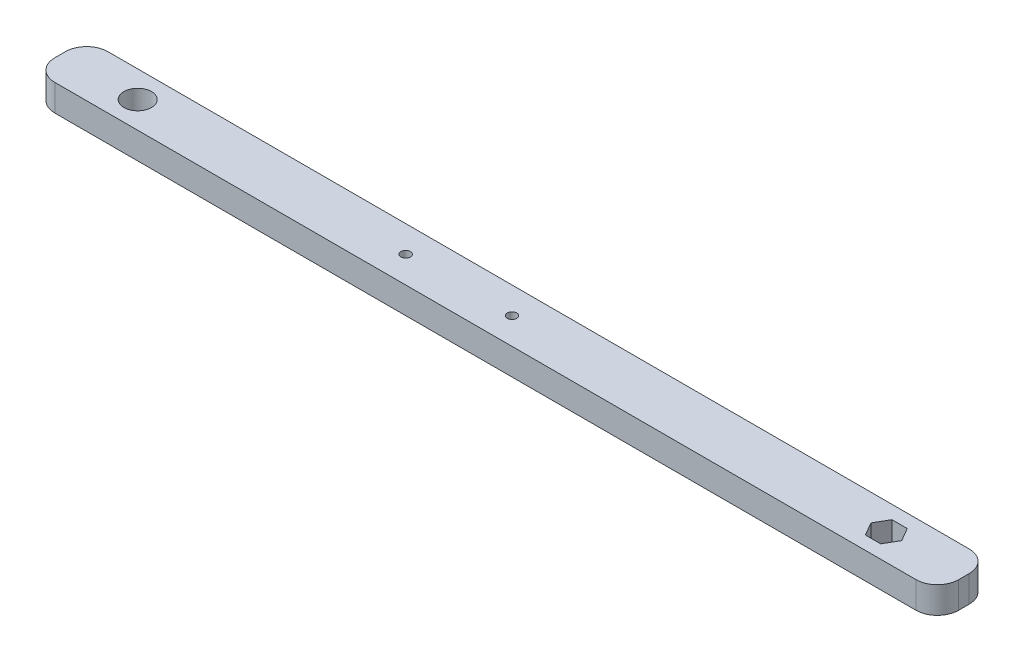
from build123d import *

# Parameters (mm, degrees)
SKETCH1_W           = 215.9
SKETCH1_H           = 12.7
SKETCH1_R           = 3.302
BOSS_EXTRUDE1_DEPTH = 6.35
FILLET1_R           = 5.08
SKETCH4_R           = 1.1303
CUT_EXTRUDE1_DEPTH  = 21.59


with BuildPart() as part:
    # Sketch1 → Boss-Extrude1 (new body)
    with BuildSketch(Plane(origin=(0, 0, 0), x_dir=(1, 0, 0), z_dir=(0, 1, 0))):
        with Locations((107.95, 6.35)):
            Rectangle(SKETCH1_W, SKETCH1_H)
        with Locations(Location((18.542, 6.35, 0), (0, 0, 270))):
            Circle(SKETCH1_R, mode=Mode.SUBTRACT)
        Polygon((199.191087105, 9.525), (195.524912895, 9.525), (193.691825791, 6.35), (195.524912895, 3.175), (199.191087105, 3.175), (201.024174209, 6.35), align=None, mode=Mode.SUBTRACT)
    extrude(amount=BOSS_EXTRUDE1_DEPTH)

    # Fillet1
    fillet1_edges = [part.edges().sort_by_distance(p)[0] for p in [
        (0, 3.175, -12.7),
        (215.9, 3.175, -12.7),
        (215.9, 3.175, 0),
        (0, 3.175, 0),
    ]]
    fillet(fillet1_edges, radius=FILLET1_R)

    # Sketch4 → Cut-Extrude1 (cut)
    with BuildSketch(Plane(origin=(0, 6.35, 0), x_dir=(1, 0, 0), z_dir=(0, 1, 0))):
        with Locations(Location((107.95, 6.35, 0), (0, 0, 270))):
            Circle(SKETCH4_R)
        with Locations(Location((82.55, 6.35, 0), (0, 0, 270))):
            Circle(SKETCH4_R)
    extrude(amount=-CUT_EXTRUDE1_DEPTH, mode=Mode.SUBTRACT)


solid = part.part
